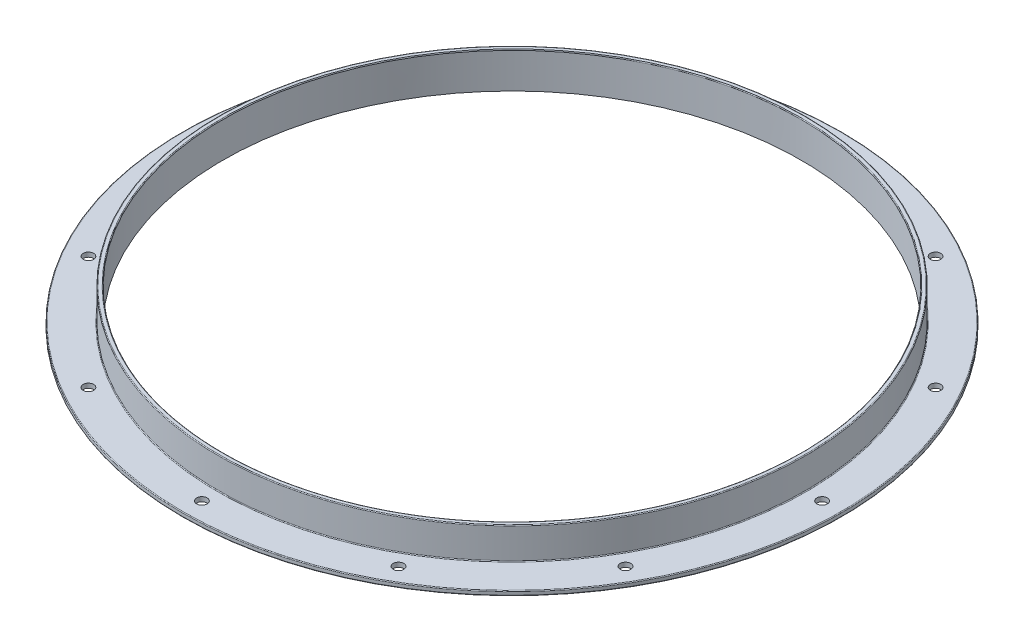
from build123d import *

# Parameters (mm, degrees)
FILLET3_R          = 0.79375
FILLET4_R          = 0.79375
SKETCH3_R          = 5.55625
CUT_EXTRUDE1_DEPTH = 496.037891455
CIRPATTERN1_COUNT  = 12


with BuildPart() as part:
    # Sketch1 → Revolve1 (revolve)
    with BuildSketch(Plane(origin=(0, 0, 0), x_dir=(0, 0, -1), z_dir=(1, 0, 0)), mode=Mode.PRIVATE) as revolve1_sk:
        Polygon((306.3875, 0), (349.25, 0), (349.25, 4.7625), (311.15, 4.7625), (311.15, 38.1), (306.3875, 38.1), align=None)
    revolve(revolve1_sk.sketch.rotate(Axis((0, 38.1, 0), (0, -1, 0)), 180), axis=Axis((0, 38.1, 0), (0, -1, 0)))

    # Fillet3
    fillet3_edges = [part.edges().sort_by_distance(p)[0] for p in [
        (0, 0, -349.25),
        (0, 4.7625, -349.25),
    ]]
    fillet(fillet3_edges, radius=FILLET3_R)

    # Fillet4
    fillet4_edges = [part.edges().sort_by_distance(p)[0] for p in [
        (0, 38.1, -306.3875),
        (0, 38.1, -311.15),
        (0, 4.7625, -311.15),
    ]]
    fillet(fillet4_edges, radius=FILLET4_R)

    # Sketch3 → Cut-Extrude1 (cut, through all)
    with BuildSketch(Plane(origin=(0, 4.7625, 0), x_dir=(-1, 0, 0), z_dir=(0, 1, 0))):
        with Locations(Location((0, -328.6125, 0), (0, 0, 90))):
            Circle(SKETCH3_R)
    cut_extrude1 = extrude(amount=-CUT_EXTRUDE1_DEPTH, mode=Mode.SUBTRACT)

    # CirPattern1: Cut-Extrude1 ×12 about axis
    cirpattern1_axis = Axis((0, 0, 0), (0, 1, 0))
    for i in range(1, CIRPATTERN1_COUNT):
        add(cut_extrude1.rotate(cirpattern1_axis, i * 360 / CIRPATTERN1_COUNT), mode=Mode.SUBTRACT)


solid = part.part
